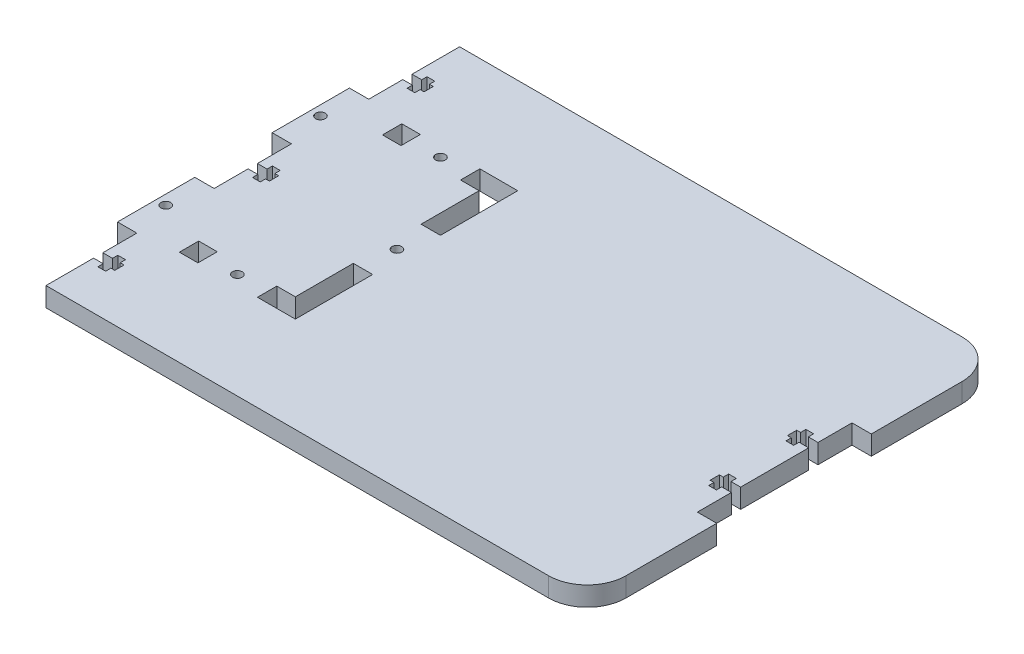
from build123d import *

# Parameters (mm, degrees)
SKETCH1_R           = 1.5875
SKETCH1_W           = 6.096
SKETCH1_H           = 6.35
BOSS_EXTRUDE1_DEPTH = 6.35


with BuildPart() as part:
    # Sketch1 → Boss-Extrude1 (new body)
    with BuildSketch(Plane(origin=(0, 0, 0), x_dir=(1, 0, 0), z_dir=(0, 1, 0))):
        with BuildLine():
            Line((-233.985969077, 84.470905347), (-68.885969077, 84.470905347))
            ThreePointArc((-68.885969077, 84.470905347), (-59.905712956, 80.751161468), (-56.185969077, 71.770905347))
            Line((-56.185969077, 71.770905347), (-56.174553175, 41.925905347))
            Line((-56.174553175, 41.925905347), (-62.514837513, 41.925905347))
            Line((-62.514837513, 41.925905347), (-62.514837513, 30.749799864))
            Line((-62.514837513, 30.749799864), (-65.689837513, 30.749799864))
            Line((-65.689837513, 30.749799864), (-65.689837513, 32.502399864))
            Line((-65.689837513, 32.502399864), (-68.229837513, 32.502399864))
            Line((-68.229837513, 32.502399864), (-68.229837513, 30.749799864))
            Line((-68.229837513, 30.749799864), (-69.499837513, 30.749799864))
            Line((-69.499837513, 30.749799864), (-69.499837513, 27.701940508))
            Line((-69.499837513, 27.701940508), (-68.229837513, 27.701940508))
            Line((-68.229837513, 27.701940508), (-68.229837513, 25.949340508))
            Line((-68.229837513, 25.949340508), (-65.689837513, 25.949340508))
            Line((-65.689837513, 25.949340508), (-65.689837513, 27.701940508))
            Line((-65.689837513, 27.701940508), (-62.514837513, 27.701940508))
            Line((-62.514837513, 27.701940508), (-62.514837513, 16.525905347))
            Line((-62.514837513, 16.525905347), (-62.514837513, 5.349799864))
            Line((-62.514837513, 5.349799864), (-65.689837513, 5.349799864))
            Line((-65.689837513, 5.349799864), (-65.689837513, 7.102399864))
            Line((-65.689837513, 7.102399864), (-68.229837513, 7.102399864))
            Line((-68.229837513, 7.102399864), (-68.229837513, 5.349799864))
            Line((-68.229837513, 5.349799864), (-69.499837513, 5.349799864))
            Line((-69.499837513, 5.349799864), (-69.499837513, 2.301940508))
            Line((-69.499837513, 2.301940508), (-68.229837513, 2.301940508))
            Line((-68.229837513, 2.301940508), (-68.229837513, 0.549340508))
            Line((-68.229837513, 0.549340508), (-65.689837513, 0.549340508))
            Line((-65.689837513, 0.549340508), (-65.689837513, 2.301940508))
            Line((-65.689837513, 2.301940508), (-62.514837513, 2.301940508))
            Line((-62.514837513, 2.301940508), (-62.514837513, -8.874094653))
            Line((-62.514837513, -8.874094653), (-56.155121852, -8.874094653))
            Line((-56.155121852, -8.874094653), (-56.14370595, -38.719094653))
            ThreePointArc((-56.14370595, -38.719094653), (-59.863449829, -47.699350774), (-68.84370595, -51.419094653))
            Line((-68.84370595, -51.419094653), (-233.985969077, -51.419094653))
            Line((-233.985969077, -51.419094653), (-233.985969077, -45.069094653))
            Line((-233.985969077, -45.069094653), (-233.985969077, -35.798024331))
            Line((-233.985969077, -35.798024331), (-230.810969077, -35.798024331))
            Line((-230.810969077, -35.798024331), (-230.810969077, -37.550624331))
            Line((-230.810969077, -37.550624331), (-228.270969077, -37.550624331))
            Line((-228.270969077, -37.550624331), (-228.270969077, -35.798024331))
            Line((-228.270969077, -35.798024331), (-227.000969077, -35.798024331))
            Line((-227.000969077, -35.798024331), (-227.000969077, -32.750164975))
            Line((-227.000969077, -32.750164975), (-228.270969077, -32.750164975))
            Line((-228.270969077, -32.750164975), (-228.270969077, -30.997564975))
            Line((-228.270969077, -30.997564975), (-230.810969077, -30.997564975))
            Line((-230.810969077, -30.997564975), (-230.810969077, -32.750164975))
            Line((-230.810969077, -32.750164975), (-233.985969077, -32.750164975))
            Line((-233.985969077, -32.750164975), (-233.985969077, -21.574094653))
            Line((-233.985969077, -21.574094653), (-240.335969077, -21.574094653))
            Line((-240.335969077, -21.574094653), (-240.335969077, 3.825905347))
            Line((-240.335969077, 3.825905347), (-233.985969077, 3.825905347))
            Line((-233.985969077, 3.825905347), (-233.985969077, 15.001975669))
            Line((-233.985969077, 15.001975669), (-230.810969077, 15.001975669))
            Line((-230.810969077, 15.001975669), (-230.810969077, 13.249375669))
            Line((-230.810969077, 13.249375669), (-228.270969077, 13.249375669))
            Line((-228.270969077, 13.249375669), (-228.270969077, 15.001975669))
            Line((-228.270969077, 15.001975669), (-227.000969077, 15.001975669))
            Line((-227.000969077, 15.001975669), (-227.000969077, 18.049835025))
            Line((-227.000969077, 18.049835025), (-228.270969077, 18.049835025))
            Line((-228.270969077, 18.049835025), (-228.270969077, 19.802435025))
            Line((-228.270969077, 19.802435025), (-230.810969077, 19.802435025))
            Line((-230.810969077, 19.802435025), (-230.810969077, 18.049835025))
            Line((-230.810969077, 18.049835025), (-233.985969077, 18.049835025))
            Line((-233.985969077, 18.049835025), (-233.985969077, 29.225905347))
            Line((-233.985969077, 29.225905347), (-240.335969077, 29.225905347))
            Line((-240.335969077, 29.225905347), (-240.335969077, 54.625905347))
            Line((-240.335969077, 54.625905347), (-233.985969077, 54.625905347))
            Line((-233.985969077, 54.625905347), (-233.985969077, 65.801975669))
            Line((-233.985969077, 65.801975669), (-230.810969077, 65.801975669))
            Line((-230.810969077, 65.801975669), (-230.810969077, 64.049375669))
            Line((-230.810969077, 64.049375669), (-228.270969077, 64.049375669))
            Line((-228.270969077, 64.049375669), (-228.270969077, 65.801975669))
            Line((-228.270969077, 65.801975669), (-227.000969077, 65.801975669))
            Line((-227.000969077, 65.801975669), (-227.000969077, 68.849835025))
            Line((-227.000969077, 68.849835025), (-228.270969077, 68.849835025))
            Line((-228.270969077, 68.849835025), (-228.270969077, 70.602435025))
            Line((-228.270969077, 70.602435025), (-230.810969077, 70.602435025))
            Line((-230.810969077, 70.602435025), (-230.810969077, 68.849835025))
            Line((-230.810969077, 68.849835025), (-233.985969077, 68.849835025))
            Line((-233.985969077, 68.849835025), (-233.985969077, 78.120905347))
            Line((-233.985969077, 78.120905347), (-233.985969077, 84.470905347))
        make_face()
        with Locations(Location((-237.160969077, 41.925905347, 0), (0, 0, 270))):
            Circle(SKETCH1_R, mode=Mode.SUBTRACT)
        with Locations(Location((-237.160969077, -8.874094653, 0), (0, 0, 270))):
            Circle(SKETCH1_R, mode=Mode.SUBTRACT)
        with Locations(Location((-186.646041016, 16.54252462, 0), (0, 0, 270))):
            Circle(SKETCH1_R, mode=Mode.SUBTRACT)
        with Locations(Location((-205.696041016, -16.836994653, 0), (0, 0, 270))):
            Circle(SKETCH1_R, mode=Mode.SUBTRACT)
        with Locations(Location((-205.696041016, 49.888805347, 0), (0, 0, 270))):
            Circle(SKETCH1_R, mode=Mode.SUBTRACT)
        Polygon((-189.821041016, -20.011994653), (-183.471041016, -20.011994653), (-183.471041016, 5.388005347), (-189.821041016, 5.388005347), (-189.821041016, -13.661994653), (-195.917041016, -13.661994653), (-195.917041016, -20.011994653), align=None, mode=Mode.SUBTRACT)
        Polygon((-189.821041016, 53.063805347), (-183.471041016, 53.063805347), (-183.471041016, 27.663805347), (-189.821041016, 27.663805347), (-189.821041016, 46.713805347), (-195.917041016, 46.713805347), (-195.917041016, 53.063805347), align=None, mode=Mode.SUBTRACT)
        with Locations((-218.523041016, -16.836994653)):
            Rectangle(SKETCH1_W, SKETCH1_H, mode=Mode.SUBTRACT)
        with Locations((-218.523041016, 49.888805347)):
            Rectangle(SKETCH1_W, SKETCH1_H, mode=Mode.SUBTRACT)
    extrude(amount=BOSS_EXTRUDE1_DEPTH)


solid = part.part
